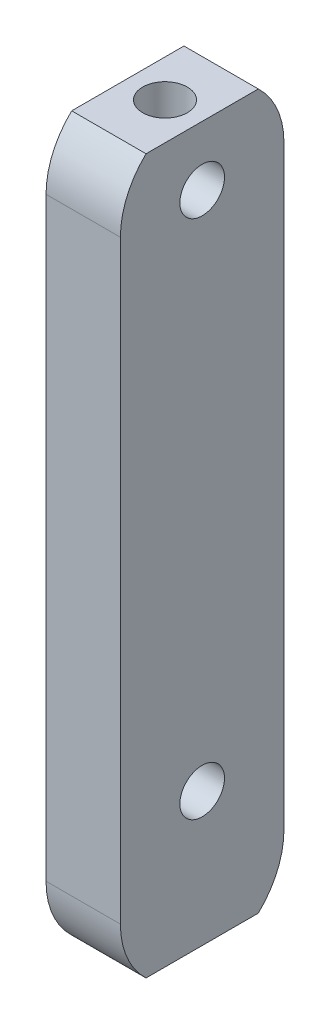
from build123d import *

# Parameters (mm, degrees)
SKETCH1_R           = 1.5
BOSS_EXTRUDE1_DEPTH = 5
SKETCH2_R           = 1.5
CUT_EXTRUDE1_DEPTH  = 5
CUT_EXTRUDE2_START  = -44
SKETCH2_2_R         = 1.5
CUT_EXTRUDE2_DEPTH  = 4


with BuildPart() as part:
    # Sketch1 → Boss-Extrude1 (new body)
    with BuildSketch(Plane(origin=(0, 0, 0), x_dir=(0, 0, -1), z_dir=(1, 0, 0))):
        with BuildLine():
            Line((-5.5, 20), (-5.5, -20))
            ThreePointArc((-5.5, -20), (-5.050348735, -22.178067412), (-3.774917218, -24))
            Line((-3.774917218, -24), (3.774917218, -24))
            ThreePointArc((3.774917218, -24), (5.050348735, -22.178067412), (5.5, -20))
            Line((5.5, -20), (5.5, 20))
            ThreePointArc((5.5, 20), (5.050348735, 22.178067412), (3.774917218, 24))
            Line((3.774917218, 24), (-3.774917218, 24))
            ThreePointArc((-3.774917218, 24), (-5.050348735, 22.178067412), (-5.5, 20))
        make_face()
        with Locations((0, 20)):
            Circle(SKETCH1_R, mode=Mode.SUBTRACT)
        with Locations((0, -15)):
            Circle(SKETCH1_R, mode=Mode.SUBTRACT)
    extrude(amount=BOSS_EXTRUDE1_DEPTH)

    # Sketch2 → Cut-Extrude1 (cut)
    with BuildSketch(Plane.XZ.offset(24)):
        with Locations(Location((2.5, 0, 0), (0, 0, 270))):
            Circle(SKETCH2_R)
    extrude(amount=-CUT_EXTRUDE1_DEPTH, mode=Mode.SUBTRACT)

    # Sketch2<2> → Cut-Extrude2 (cut)
    with BuildSketch(Plane.XZ.offset(24).offset(CUT_EXTRUDE2_START)):
        with Locations(Location((2.5, 0, 0), (0, 0, 270))):
            Circle(SKETCH2_2_R)
    extrude(amount=-CUT_EXTRUDE2_DEPTH, mode=Mode.SUBTRACT)


solid = part.part
